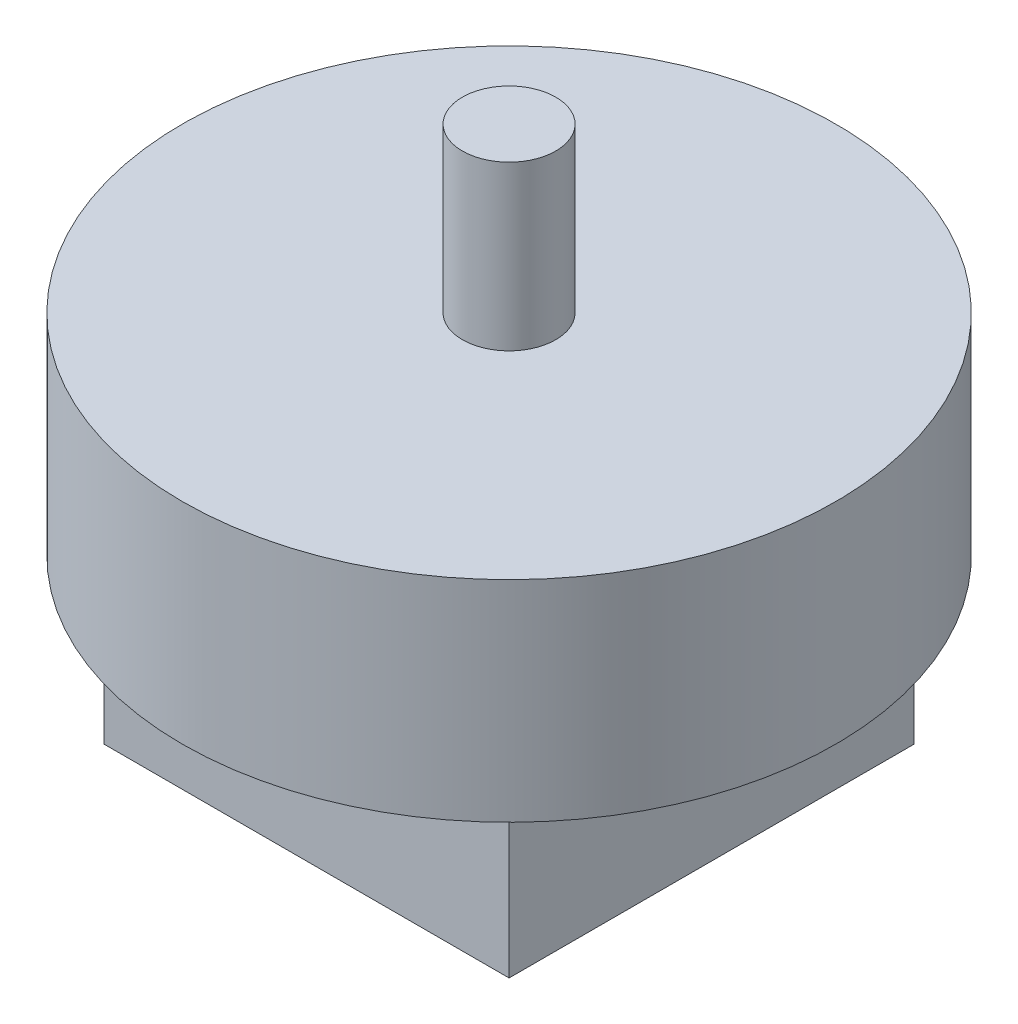
from build123d import *

# Parameters (mm, degrees)
SKETCH1_R           = 14
BOSS_EXTRUDE1_DEPTH = 9
SKETCH3_W           = 17.35
SKETCH3_H           = 17.35
BOSS_EXTRUDE2_DEPTH = 7
SKETCH4_R           = 1.7
CUT_EXTRUDE1_DEPTH  = 7
SKETCH5_R           = 2
BOSS_EXTRUDE3_DEPTH = 7


with BuildPart() as part:
    # Sketch1 → Boss-Extrude1 (new body)
    with BuildSketch(Plane(origin=(0, 0, 0), x_dir=(1, 0, 0), z_dir=(0, 1, 0))):
        with Locations(Location((0, 0, 0), (0, 0, 270))):
            Circle(SKETCH1_R)
    extrude(amount=BOSS_EXTRUDE1_DEPTH)

    # Sketch3 → Boss-Extrude2 (add)
    with BuildSketch(Plane.XZ):
        Rectangle(SKETCH3_W, SKETCH3_H)
    extrude(amount=BOSS_EXTRUDE2_DEPTH)

    # Sketch4 → Cut-Extrude1 (cut)
    with BuildSketch(Plane.XZ.offset(7)):
        with Locations(Location((-5.952043792, 5.675, 0), (0, 0, 270))):
            Circle(SKETCH4_R)
        with Locations(Location((-5.952043792, -5.316444521, 0), (0, 0, 270))):
            Circle(SKETCH4_R)
        with Locations(Location((5.675, -5.316444521, 0), (0, 0, 270))):
            Circle(SKETCH4_R)
        with Locations(Location((5.675, 5.675, 0), (0, 0, 270))):
            Circle(SKETCH4_R)
    extrude(amount=-CUT_EXTRUDE1_DEPTH, mode=Mode.SUBTRACT)

    # Sketch5 → Boss-Extrude3 (add)
    with BuildSketch(Plane(origin=(0, 9, 0), x_dir=(1, 0, 0), z_dir=(0, 1, 0))):
        with Locations(Location((0, 0, 0), (0, 0, 270))):
            Circle(SKETCH5_R)
    extrude(amount=BOSS_EXTRUDE3_DEPTH)


solid = part.part
